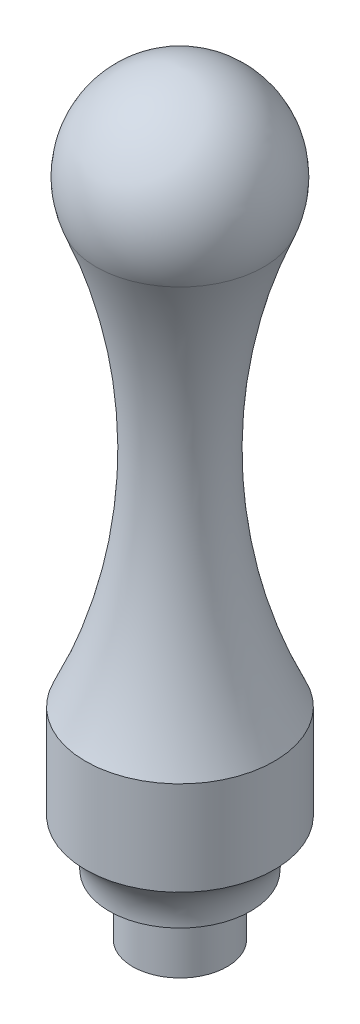
from build123d import *


with BuildPart() as part:
    # Sketch1 → Base-Revolve (revolve)
    with BuildSketch(Plane.XY, mode=Mode.PRIVATE) as base_revolve_sk:
        with BuildLine():
            Line((0, 0), (5, 0))
            Line((5, 0), (5, 6.35))
            Line((5, 6.35), (7.5, 6.35))
            ThreePointArc((7.5, 6.35), (8.15921798, 9.167356917), (10, 11.399752469))
            Line((10, 11.399752469), (10, 21.35))
            ThreePointArc((10, 21.35), (4.672504387, 43.636025128), (8.888420475, 66.158795319))
            ThreePointArc((8.888420475, 66.158795319), (8.07243614, 75.409339174), (0, 80))
            Line((0, 80), (0, 0))
        make_face()
    revolve(base_revolve_sk.sketch.rotate(Axis((0, 0, 0), (0, -1, 0)), 90), axis=Axis((0, 0, 0), (0, -1, 0)))


solid = part.part
